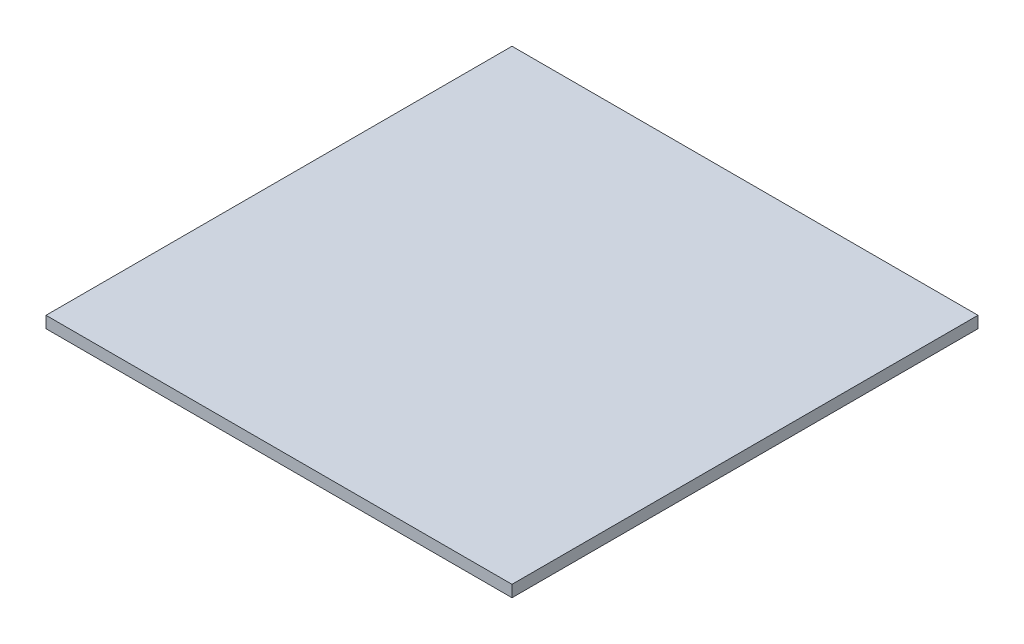
from build123d import *

# Parameters (mm, degrees)
BASE_DEPTH          = 2.5
BASE_DEPTH_BACK     = 2.5
SKETCH1_W           = 200
SKETCH1_H           = 200
SKETCH2_W           = 90
SKETCH2_H           = 95
SKETCH2_W_2         = 85
SKETCH2_H_2         = 75
BATTERYHOLDER_DEPTH = 25


with BuildPart() as part:
    # Sketch1 → Base (new, two sides: drawn at the far end of the back side and taken through both)
    with BuildSketch(Plane(origin=(0, 0, 0), x_dir=(1, 0, 0), z_dir=(0, 1, 0)).offset(-BASE_DEPTH_BACK)):
        Rectangle(SKETCH1_W, SKETCH1_H)
    extrude(amount=BASE_DEPTH + BASE_DEPTH_BACK)

    # Sketch2 → BatteryHolder (add)
    with BuildSketch(Plane(origin=(0, -2.5, 0), x_dir=(-1, 0, 0), z_dir=(0, -1, 0))):
        Rectangle(SKETCH2_W, SKETCH2_H)
        Rectangle(SKETCH2_W_2, SKETCH2_H_2, mode=Mode.SUBTRACT)
    extrude(amount=BATTERYHOLDER_DEPTH)


solid = part.part
